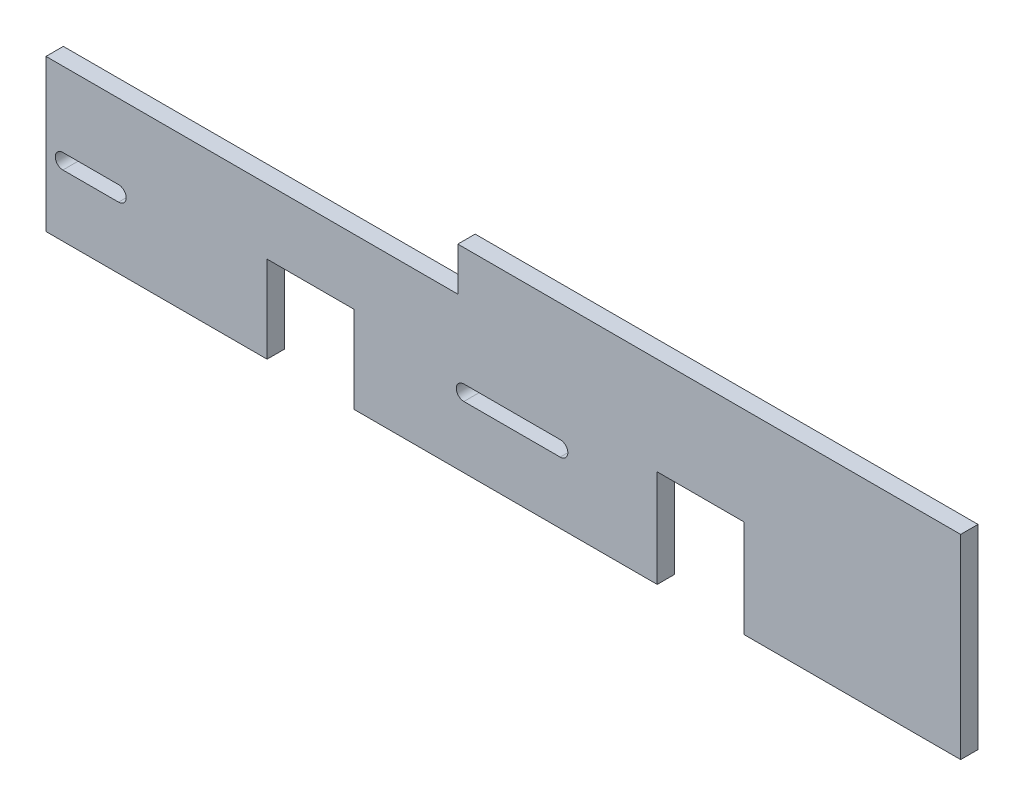
from build123d import *

# Parameters (mm, degrees)
SKETCH1_W           = 211
SKETCH1_H           = 45
BOSS_EXTRUDE1_DEPTH = 4
CUT_EXTRUDE1_REACH  = 109.947
SKETCH2_W           = 95
SKETCH2_H           = 10
CUT_EXTRUDE2_REACH  = 109.947
SKETCH3_R           = 4.5
SKETCH3_W           = 20
SKETCH3_H           = 22.5
CUT_EXTRUDE3_DEPTH  = 4
CUT_EXTRUDE4_DEPTH  = 4
SKETCH7_R           = 5.771912947
CUT_EXTRUDE6_DEPTH  = 108.94674613
CUT_EXTRUDE7_REACH  = 109.947


with BuildPart() as part:
    # Sketch1 → Boss-Extrude1 (new body)
    with BuildSketch(Plane.XY):
        Rectangle(SKETCH1_W, SKETCH1_H)
    extrude(amount=BOSS_EXTRUDE1_DEPTH)

    # Sketch2 → Cut-Extrude1 (cut, up to next)
    with BuildSketch(Plane.XY.offset(4), mode=Mode.PRIVATE) as cut_extrude1_sk1:
        with Locations((-58, 17.5)):
            Rectangle(SKETCH2_W, SKETCH2_H)
    cut_extrude1_tool1 = extrude(cut_extrude1_sk1.sketch, amount=-CUT_EXTRUDE1_REACH, mode=Mode.PRIVATE) & part.part
    add(cut_extrude1_tool1.solids().sort_by_distance((-58, 17.5, 4))[0], mode=Mode.SUBTRACT)

    # Sketch3 → Cut-Extrude2 (cut, up to next)
    with BuildSketch(Plane.XY.offset(4), mode=Mode.PRIVATE) as cut_extrude2_sk1:
        with Locations((-44.5, -10.5)):
            Circle(SKETCH3_R)
    cut_extrude2_tool1 = extrude(cut_extrude2_sk1.sketch, amount=-CUT_EXTRUDE2_REACH, mode=Mode.PRIVATE) & part.part
    # Sketch3 → Cut-Extrude2 (cut, up to next)
    with BuildSketch(Plane.XY.offset(4), mode=Mode.PRIVATE) as cut_extrude2_sk2:
        with Locations((45.5, -11.25)):
            Rectangle(SKETCH3_W, SKETCH3_H)
        with Locations((45.5, -10.5)):
            Circle(SKETCH3_R, mode=Mode.SUBTRACT)
    cut_extrude2_tool2 = extrude(cut_extrude2_sk2.sketch, amount=-CUT_EXTRUDE2_REACH, mode=Mode.PRIVATE) & part.part
    add(cut_extrude2_tool1.solids().sort_by_distance((-44.5, -10.5, 4))[0], mode=Mode.SUBTRACT)
    add(cut_extrude2_tool2.solids().sort_by_distance((55.19896, -11.25, 4))[0], mode=Mode.SUBTRACT)


with BuildPart() as cut_extrude2_piece_1:
    # of the separate pieces the step leaves, piece 1, a body of its own (cut_extrude2_pieces)
    add(part.part.solids().sort_by_distance((-105.5, -22.5, 0))[0])

    # Sketch4 → Cut-Extrude3 (cut)
    with BuildSketch(Plane(origin=(0, 0, 0), x_dir=(-1, 0, 0), z_dir=(0, 0, -1))):
        Polygon((44.5, -22.5), (34.5, -22.5), (34.5, -2.5), (54.5, -2.5), (54.5, -22.5), align=None)
    extrude(amount=-CUT_EXTRUDE3_DEPTH, mode=Mode.SUBTRACT)

    # Sketch5 → Cut-Extrude4 (cut)
    with BuildSketch(Plane(origin=(0, 0, 0), x_dir=(-1, 0, 0), z_dir=(0, 0, -1))):
        with BuildLine():
            Line((101.601478709, -4.75), (88.754183798, -4.75))
            ThreePointArc((88.754183798, -4.75), (87.004183798, -6.5), (88.754183798, -8.25))
            Line((88.754183798, -8.25), (101.601478709, -8.25))
            ThreePointArc((101.601478709, -8.25), (103.351478709, -6.5), (101.601478709, -4.75))
        make_face()
    extrude(amount=-CUT_EXTRUDE4_DEPTH, mode=Mode.SUBTRACT)

    # Sketch8 → Cut-Extrude7 (cut, up to next)
    with BuildSketch(Plane(origin=(0, 0, 0), x_dir=(-1, 0, 0), z_dir=(0, 0, -1)), mode=Mode.PRIVATE) as cut_extrude7_sk1:
        with BuildLine():
            Line((-13.125491326, -8.25), (9.100552063, -8.25))
            ThreePointArc((9.100552063, -8.25), (10.850552063, -6.5), (9.100552063, -4.75))
            Line((9.100552063, -4.75), (-3.792824267, -4.75))
            Line((-3.792824267, -4.75), (-13.125491326, -4.75))
            ThreePointArc((-13.125491326, -4.75), (-14.875491326, -6.5), (-13.125491326, -8.25))
        make_face()
    cut_extrude7_tool1 = extrude(cut_extrude7_sk1.sketch, amount=-CUT_EXTRUDE7_REACH, mode=Mode.PRIVATE) & cut_extrude2_piece_1.part
    add(cut_extrude7_tool1.solids().sort_by_distance((2.01247, -6.5, 0))[0], mode=Mode.SUBTRACT)


with BuildPart() as cut_extrude2_piece_2:
    # of the separate pieces the step leaves, piece 2, a body of its own (cut_extrude2_pieces)
    add(part.part.solids().sort_by_distance((50, -10.5, 0))[0])

    # Sketch7 → Cut-Extrude6 (cut, through all)
    with BuildSketch(Plane(origin=(0, 0, 0), x_dir=(-1, 0, 0), z_dir=(0, 0, -1))):
        with Locations((-45.5, -10.5)):
            Circle(SKETCH7_R)
    extrude(amount=-CUT_EXTRUDE6_DEPTH, mode=Mode.SUBTRACT)


solid = cut_extrude2_piece_1.part
